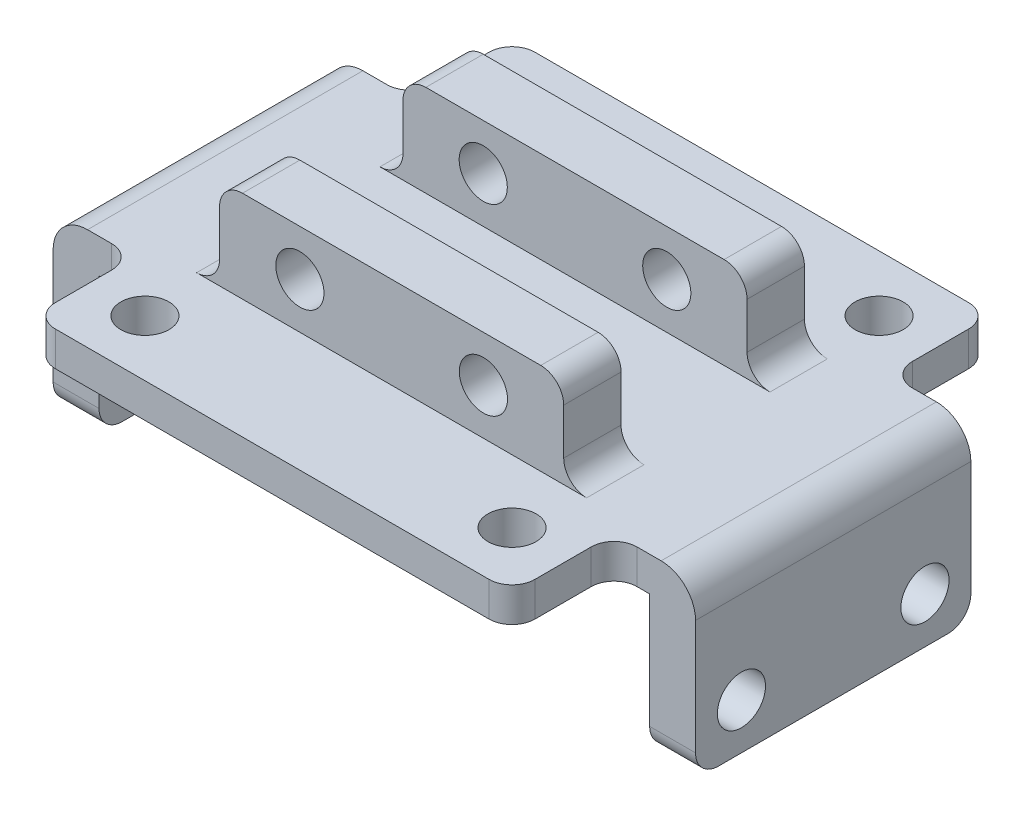
from build123d import *

# Parameters (mm, degrees)
SKETCH1_R           = 2.1
BOSS_EXTRUDE1_DEPTH = 3
SKETCH2_W           = 4
SKETCH2_H           = 24
BOSS_EXTRUDE2_DEPTH = 15
SKETCH5_R           = 2.1
CUT_EXTRUDE3_DEPTH  = 65
FILLET2_R           = 2
FILLET3_R           = 3
SKETCH6_W           = 30
SKETCH6_H           = 5
BOSS_EXTRUDE3_DEPTH = 8
FILLET5_R           = 2
SKETCH9_R           = 2.1
CUT_EXTRUDE8_DEPTH  = 34


with BuildPart() as part:
    # Sketch1 → Boss-Extrude1 (new body)
    with BuildSketch(Plane(origin=(0, 0, 0), x_dir=(1, 0, 0), z_dir=(0, 1, 0))):
        Polygon((-20.9, -20.9), (20.9, -20.9), (20.9, -12), (28, -12), (28, 12), (20.9, 12), (20.9, 20.9), (-20.9, 20.9), (-20.9, 12), (-28, 12), (-28, -12), (-20.9, -12), align=None)
        with Locations(Location((-16, 16, 0), (0, 0, 270))):
            Circle(SKETCH1_R, mode=Mode.SUBTRACT)
        with Locations(Location((16, 16, 0), (0, 0, 270))):
            Circle(SKETCH1_R, mode=Mode.SUBTRACT)
        with Locations(Location((16, -16, 0), (0, 0, 270))):
            Circle(SKETCH1_R, mode=Mode.SUBTRACT)
        with Locations(Location((-16, -16, 0), (0, 0, 270))):
            Circle(SKETCH1_R, mode=Mode.SUBTRACT)
    extrude(amount=BOSS_EXTRUDE1_DEPTH)

    # Sketch2 → Boss-Extrude2 (add)
    with BuildSketch(Plane(origin=(0, 3, 0), x_dir=(1, 0, 0), z_dir=(0, 1, 0))):
        with Locations((-26, 0)):
            Rectangle(SKETCH2_W, SKETCH2_H)
        with Locations((26, 0)):
            Rectangle(SKETCH2_W, SKETCH2_H)
    extrude(amount=-BOSS_EXTRUDE2_DEPTH)

    # Sketch5 → Cut-Extrude3 (cut)
    with BuildSketch(Plane.ZY.offset(28)):
        with Locations((-7.999616758, -8)):
            Circle(SKETCH5_R)
        with Locations((7.999616758, -8)):
            Circle(SKETCH5_R)
    extrude(amount=-CUT_EXTRUDE3_DEPTH, mode=Mode.SUBTRACT)

    # Fillet2
    fillet2_edges = [part.edges().sort_by_distance(p)[0] for p in [
        (-20.9, 1.5, -12),
        (-20.9, 1.5, -20.9),
        (20.9, 1.5, -20.9),
        (20.9, 1.5, -12),
        (20.9, 1.5, 12),
        (20.9, 1.5, 20.9),
        (-20.9, 1.5, 20.9),
        (-20.9, 1.5, 12),
        (-26, -12, -12),
        (-26, -12, 12),
        (26, -12, 12),
        (26, -12, -12),
    ]]
    fillet(fillet2_edges, radius=FILLET2_R)

    # Fillet3
    fillet3_edges = [part.edges().sort_by_distance(p)[0] for p in [
        (28, 3, 0),
        (-28, 3, 0),
    ]]
    fillet(fillet3_edges, radius=FILLET3_R)

    # Sketch6 → Boss-Extrude3 (add)
    with BuildSketch(Plane(origin=(0, 3, 0), x_dir=(1, 0, 0), z_dir=(0, 1, 0))):
        with Locations((0, 7.992313958)):
            Rectangle(SKETCH6_W, SKETCH6_H)
        with Locations((0, -7.992313958)):
            Rectangle(SKETCH6_W, SKETCH6_H)
    extrude(amount=BOSS_EXTRUDE3_DEPTH)

    # Fillet5
    fillet5_edges = [part.edges().sort_by_distance(p)[0] for p in [
        (15, 3, 7.992313958),
        (-15, 3, 7.992313958),
        (15, 11, 7.992313958),
        (-15, 11, 7.992313958),
        (-15, 3, -7.992313958),
        (15, 3, -7.992313958),
        (-15, 11, -7.992313958),
        (15, 11, -7.992313958),
    ]]
    fillet(fillet5_edges, radius=FILLET5_R)

    # Sketch9 → Cut-Extrude8 (cut)
    with BuildSketch(Plane.XY.offset(10.492313958)):
        with Locations((-8, 7)):
            Circle(SKETCH9_R)
        with Locations((8, 7)):
            Circle(SKETCH9_R)
    extrude(amount=-CUT_EXTRUDE8_DEPTH, mode=Mode.SUBTRACT)


solid = part.part
